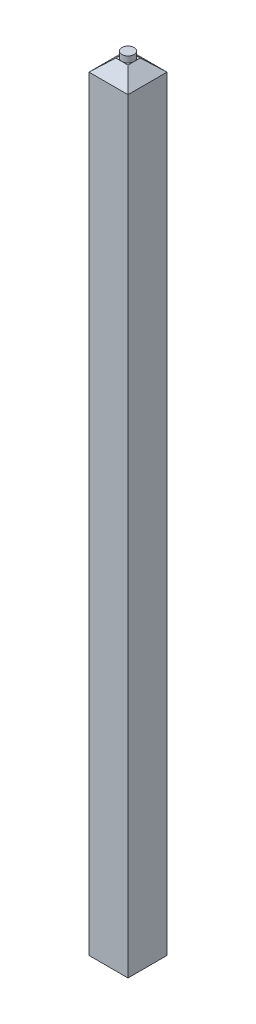
from build123d import *

# Parameters (mm, degrees)
SKETCH1_W           = 0.64
SKETCH1_H           = 0.64
BOSS_EXTRUDE1_DEPTH = 12.54
SKETCH5_R           = 0.1
BOSS_EXTRUDE2_DEPTH = 0.1


with BuildPart() as part:
    # Sketch1 → Boss-Extrude1 (new body)
    with BuildSketch(Plane(origin=(0, 0, 0), x_dir=(1, 0, 0), z_dir=(0, 1, 0))):
        Rectangle(SKETCH1_W, SKETCH1_H)
    extrude(amount=BOSS_EXTRUDE1_DEPTH)

    # Sketch3 → section 0 of loft1
    with BuildSketch(Plane(origin=(0, 12.74, 0), x_dir=(1, 0, 0), z_dir=(0, 1, 0)), mode=Mode.PRIVATE) as loft1_s0:
        with BuildLine():
            Line((0.1, 0.1), (-0.1, 0.1))
            Line((-0.1, 0.1), (-0.1, -0.1))
            Line((-0.1, -0.1), (0.1, -0.1))
            Line((0.1, -0.1), (0.1, 0.1))
        make_face()
    # loft up to a face of the part (loft1)
    loft([loft1_s0.sketch, part.faces().sort_by_distance((0, 12.54, 0))[0]])

    # Sketch4 → section 0 of loft2
    with BuildSketch(Plane(origin=(0, -0.2, 0), x_dir=(-1, 0, 0), z_dir=(0, -1, 0)), mode=Mode.PRIVATE) as loft2_s0:
        with BuildLine():
            Line((0.1, 0.1), (-0.1, 0.1))
            Line((-0.1, 0.1), (-0.1, -0.1))
            Line((-0.1, -0.1), (0.1, -0.1))
            Line((0.1, -0.1), (0.1, 0.1))
        make_face()
    # loft up to a face of the part (loft2)
    loft([loft2_s0.sketch, part.faces().sort_by_distance((0, 0, 0))[0]])

    # Sketch5 → Boss-Extrude2 (add)
    with BuildSketch(Plane(origin=(0, 12.74, 0), x_dir=(1, 0, 0), z_dir=(0, 1, 0))):
        with Locations(Location((0, 0, 0), (0, 0, 270))):
            Circle(SKETCH5_R)
    extrude(amount=BOSS_EXTRUDE2_DEPTH)


solid = part.part
